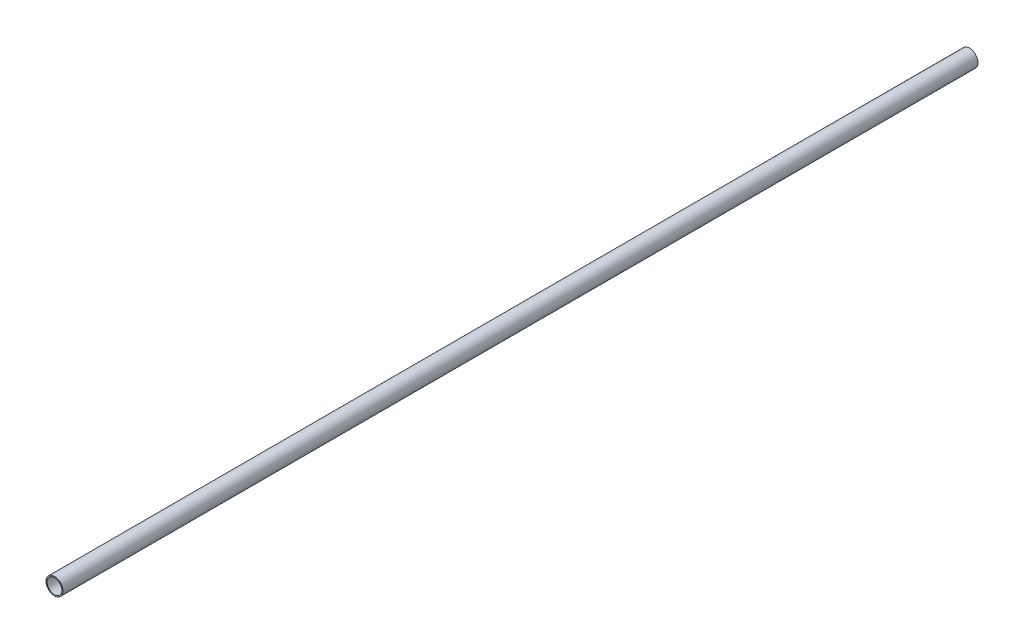
from build123d import *

# Parameters (mm, degrees)
SKETCH1_R           = 12.7
SKETCH1_R_2         = 11.049
BOSS_EXTRUDE1_DEPTH = 1371.6


with BuildPart() as part:
    # Sketch1 → Boss-Extrude1 (new body)
    with BuildSketch(Plane.XY):
        Circle(SKETCH1_R)
        Circle(SKETCH1_R_2, mode=Mode.SUBTRACT)
    extrude(amount=BOSS_EXTRUDE1_DEPTH)


solid = part.part
